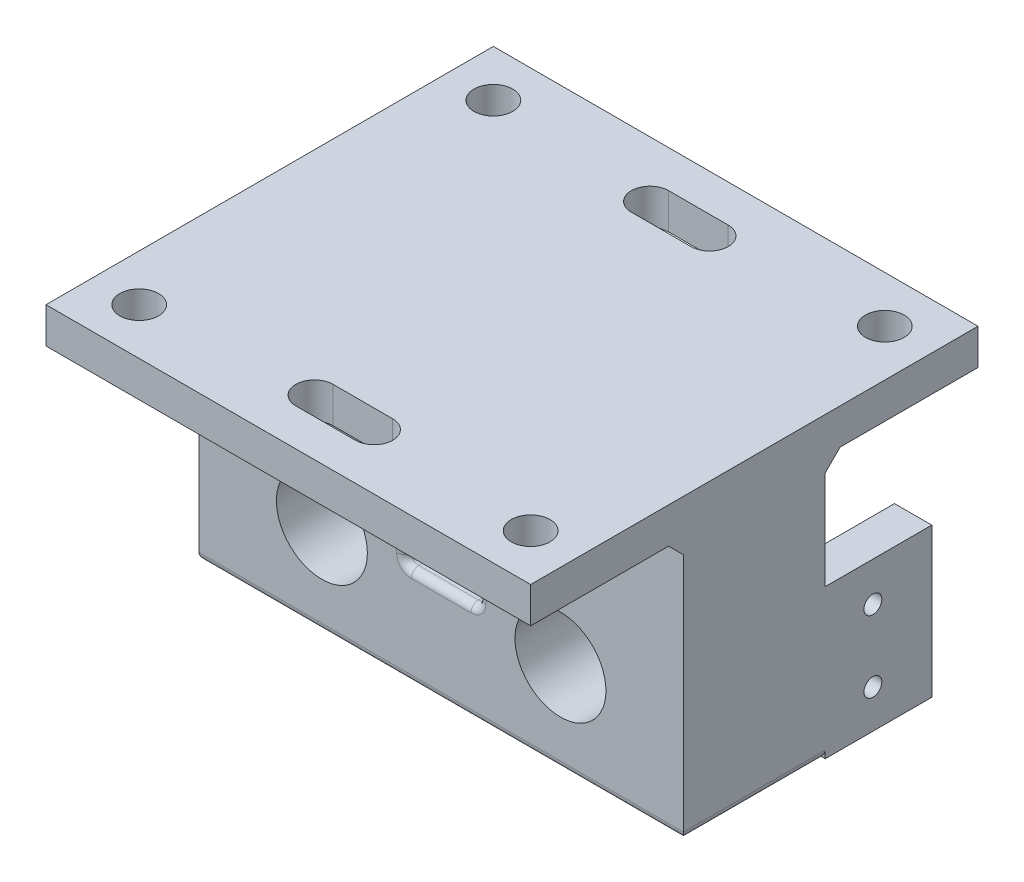
from build123d import *

# Parameters (mm, degrees)
SKETCH1_W           = 65
SKETCH1_H           = 40
SKETCH1_R           = 6.1
BOSS_EXTRUDE1_DEPTH = 19
SKETCH4_W           = 65
SKETCH4_H           = 14.8
BOSS_EXTRUDE2_DEPTH = 35
SKETCH6_W           = 10
SKETCH6_H           = 12
CUT_EXTRUDE1_DEPTH  = 71.109485806
CUT_EXTRUDE3_DEPTH  = 76.779284768
FILLET1_R           = 1
SKETCH9_W           = 65
SKETCH9_H           = 14.8
CUT_EXTRUDE4_DEPTH  = 5
SKETCH10_W          = 65
SKETCH10_H          = 14.8
CUT_EXTRUDE5_DEPTH  = 5
SKETCH11_R          = 2.6
CUT_EXTRUDE6_DEPTH  = 73.955465868
CUT_EXTRUDE7_DEPTH  = 10
CHAMFER1_SIZE       = 2
SKETCH13_W          = 14.3
SKETCH13_H          = 20
SKETCH13_R          = 1.2
BOSS_EXTRUDE3_DEPTH = 5


with BuildPart() as part:
    # Sketch1 → Boss-Extrude1 (new body)
    with BuildSketch(Plane.XY):
        with Locations((14, 7.8)):
            Rectangle(SKETCH1_W, SKETCH1_H)
        with Locations((-2, 0)):
            Circle(SKETCH1_R, mode=Mode.SUBTRACT)
        with Locations((30, 0)):
            Circle(SKETCH1_R, mode=Mode.SUBTRACT)
    extrude(amount=-BOSS_EXTRUDE1_DEPTH)

    # Sketch4 → Boss-Extrude2 (add, symmetric)
    with BuildSketch(Plane.XY.offset(-9.5)):
        with Locations((14, 20.4)):
            Rectangle(SKETCH4_W, SKETCH4_H)
    extrude(amount=BOSS_EXTRUDE2_DEPTH, both=True)

    # Sketch6 → Cut-Extrude1 (cut, through all)
    with BuildSketch(Plane.XY):
        with Locations((14, 7)):
            Rectangle(SKETCH6_W, SKETCH6_H)
    extrude(amount=-CUT_EXTRUDE1_DEPTH, mode=Mode.SUBTRACT)

    # Sketch8 → Cut-Extrude3 (cut, through all)
    with BuildSketch(Plane(origin=(0, 27.8, 0), x_dir=(1, 0, 0), z_dir=(0, 1, 0))):
        with BuildLine():
            Line((18, 29.5), (10, 29.5))
            ThreePointArc((10, 29.5), (7.5, 32), (10, 34.5))
            Line((10, 34.5), (18, 34.5))
            ThreePointArc((18, 34.5), (20.5, 32), (18, 29.5))
        make_face()
        with BuildLine():
            Line((18, -10.5), (10, -10.5))
            ThreePointArc((10, -10.5), (7.5, -13), (10, -15.5))
            Line((10, -15.5), (18, -15.5))
            ThreePointArc((18, -15.5), (20.5, -13), (18, -10.5))
        make_face()
    extrude(amount=-CUT_EXTRUDE3_DEPTH, mode=Mode.SUBTRACT)

    # Fillet1
    fillet1_edges = [part.edges().sort_by_distance(p)[0] for p in [
        (14, 1, -19),
        (9, 7, -19),
        (19, 7, -19),
        (9, 1, -9.5),
        (19, 1, -9.5),
        (9, 7, 0),
        (14, 1, 0),
        (19, 7, 0),
        (14, -12.2, 0),
        (46.5, -12.2, -9.5),
        (-18.5, -12.2, -9.5),
        (14, -12.2, -19),
    ]]
    fillet(fillet1_edges, radius=FILLET1_R)

    # Sketch9 → Cut-Extrude4 (cut)
    with BuildSketch(Plane.XY.offset(25.5)):
        with Locations((14, 20.4)):
            Rectangle(SKETCH9_W, SKETCH9_H)
    extrude(amount=-CUT_EXTRUDE4_DEPTH, mode=Mode.SUBTRACT)

    # Sketch10 → Cut-Extrude5 (cut)
    with BuildSketch(Plane(origin=(0, 0, -44.5), x_dir=(-1, 0, 0), z_dir=(0, 0, -1))):
        with Locations((-14, 20.4)):
            Rectangle(SKETCH10_W, SKETCH10_H)
    extrude(amount=-CUT_EXTRUDE5_DEPTH, mode=Mode.SUBTRACT)

    # Sketch11 → Cut-Extrude6 (cut, through all)
    with BuildSketch(Plane(origin=(0, 27.8, 0), x_dir=(1, 0, 0), z_dir=(0, 1, 0))):
        with Locations(Location((40.25, -14.25, 0), (0, 0, 270))):
            Circle(SKETCH11_R)
        with Locations(Location((40.25, 33.25, 0), (0, 0, 180))):
            Circle(SKETCH11_R)
        with Locations(Location((-12.25, 33.25, 0), (0, 0, 270))):
            Circle(SKETCH11_R)
        with Locations(Location((-12.25, -14.25, 0), (0, 0, 180))):
            Circle(SKETCH11_R)
    extrude(amount=-CUT_EXTRUDE6_DEPTH, mode=Mode.SUBTRACT)

    # Sketch12 → Cut-Extrude7 (cut)
    with BuildSketch(Plane.XZ.offset(-13)):
        with BuildLine():
            Line((-18.5, -39.5), (46.5, -39.5))
            Line((46.5, -39.5), (46.5, -19))
            Line((46.5, -19), (20, -19))
            ThreePointArc((20, -19), (19.292893219, -18.707106781), (19, -18))
            Line((19, -18), (19, -1))
            ThreePointArc((19, -1), (19.292893219, -0.292893219), (20, 0))
            Line((20, 0), (46.5, 0))
            Line((46.5, 0), (46.5, 20.5))
            Line((46.5, 20.5), (-18.5, 20.5))
            Line((-18.5, 20.5), (-18.5, 0))
            Line((-18.5, 0), (8, 0))
            ThreePointArc((8, 0), (8.707106781, -0.292893219), (9, -1))
            Line((9, -1), (9, -18))
            ThreePointArc((9, -18), (8.707106781, -18.707106781), (8, -19))
            Line((8, -19), (-18.5, -19))
            Line((-18.5, -19), (-18.5, -39.5))
        make_face()
    extrude(amount=-CUT_EXTRUDE7_DEPTH, mode=Mode.SUBTRACT)

    # Chamfer1
    chamfer1_edges = [part.edges().sort_by_distance(p)[0] for p in [
        (-5.25, 23, -19),
        (8.707106781, 23, -18.707106781),
        (9, 23, -9.5),
        (8.707106781, 23, -0.292893219),
        (-5.25, 23, 0),
        (33.25, 23, 0),
        (19.292893219, 23, -0.292893219),
        (19, 23, -9.5),
        (19.292893219, 23, -18.707106781),
        (33.25, 23, -19),
    ]]
    chamfer(chamfer1_edges, length=CHAMFER1_SIZE)

    # Sketch13 → Boss-Extrude3 (add)
    with BuildSketch(Plane(origin=(46.5, 0, 0), x_dir=(0, 0, -1), z_dir=(1, 0, 0))):
        with Locations((26.15, -2.2)):
            Rectangle(SKETCH13_W, SKETCH13_H)
        with Locations((25.4, 2.55)):
            Circle(SKETCH13_R, mode=Mode.SUBTRACT)
        with Locations((25.4, -7.05)):
            Circle(SKETCH13_R, mode=Mode.SUBTRACT)
    extrude(amount=-BOSS_EXTRUDE3_DEPTH)


solid = part.part
